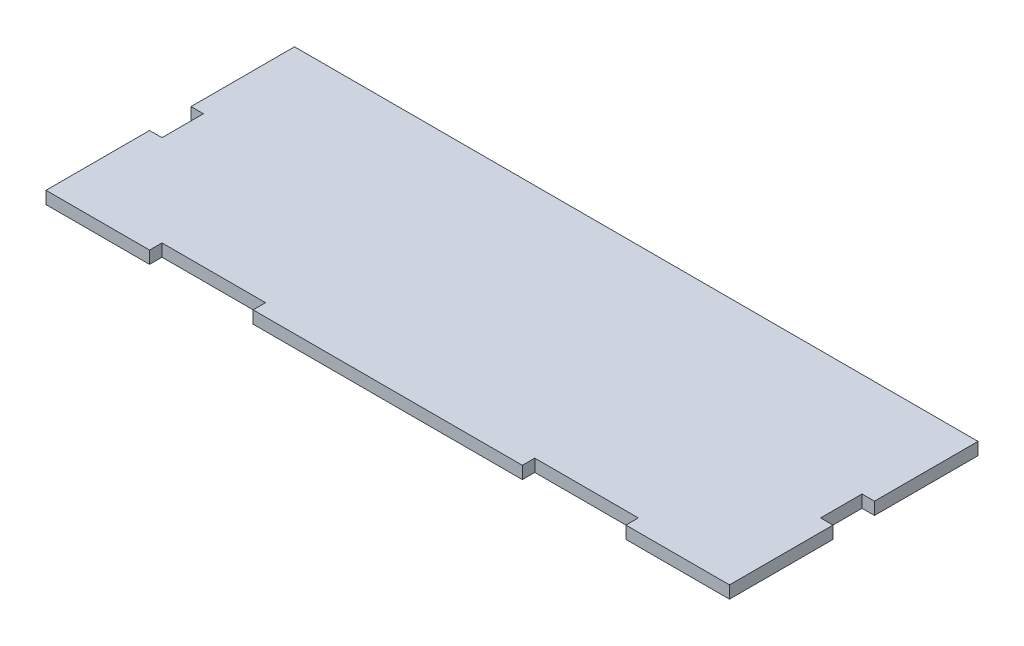
from build123d import *

# Parameters (mm, degrees)
BOSS_EXTRUDE2_DEPTH = 3


with BuildPart() as part:
    # Sketch1 → Boss-Extrude2 (new body)
    with BuildSketch(Plane(origin=(0, 0, 0), x_dir=(1, 0, 0), z_dir=(0, 1, 0))):
        Polygon((82.5, -30), (57.5, -30), (57.5, -27), (32.5, -27), (32.5, -30), (-32.5, -30), (-32.5, -27), (-57.5, -27), (-57.5, -30), (-82.5, -30), (-82.5, -5), (-79.5, -5), (-79.5, 5), (-82.5, 5), (-82.5, 30), (82.5, 30), (82.5, 5), (79.5, 5), (79.5, -5), (82.5, -5), align=None)
    extrude(amount=BOSS_EXTRUDE2_DEPTH)


solid = part.part
